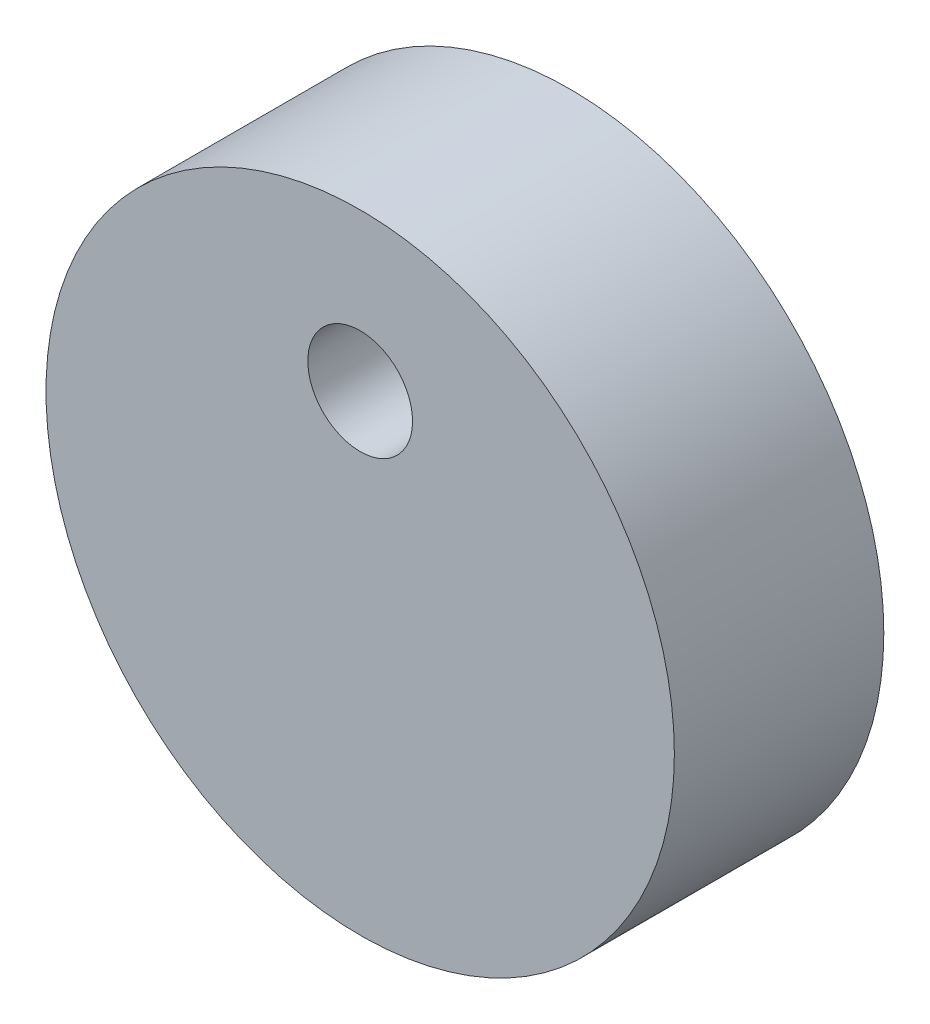
from build123d import *

# Parameters (mm, degrees)
SKETCH1_R           = 38.1
BOSS_EXTRUDE1_DEPTH = 25.4
SKETCH2_R           = 6.35
CUT_EXTRUDE1_DEPTH  = 76.2


with BuildPart() as part:
    # Sketch1 → Boss-Extrude1 (new body)
    with BuildSketch(Plane.XY):
        Circle(SKETCH1_R)
    extrude(amount=BOSS_EXTRUDE1_DEPTH)

    # Sketch2 → Cut-Extrude1 (cut)
    with BuildSketch(Plane.XY.offset(25.4)):
        with Locations((0, 19.05)):
            Circle(SKETCH2_R)
    extrude(amount=-CUT_EXTRUDE1_DEPTH, mode=Mode.SUBTRACT)


solid = part.part
